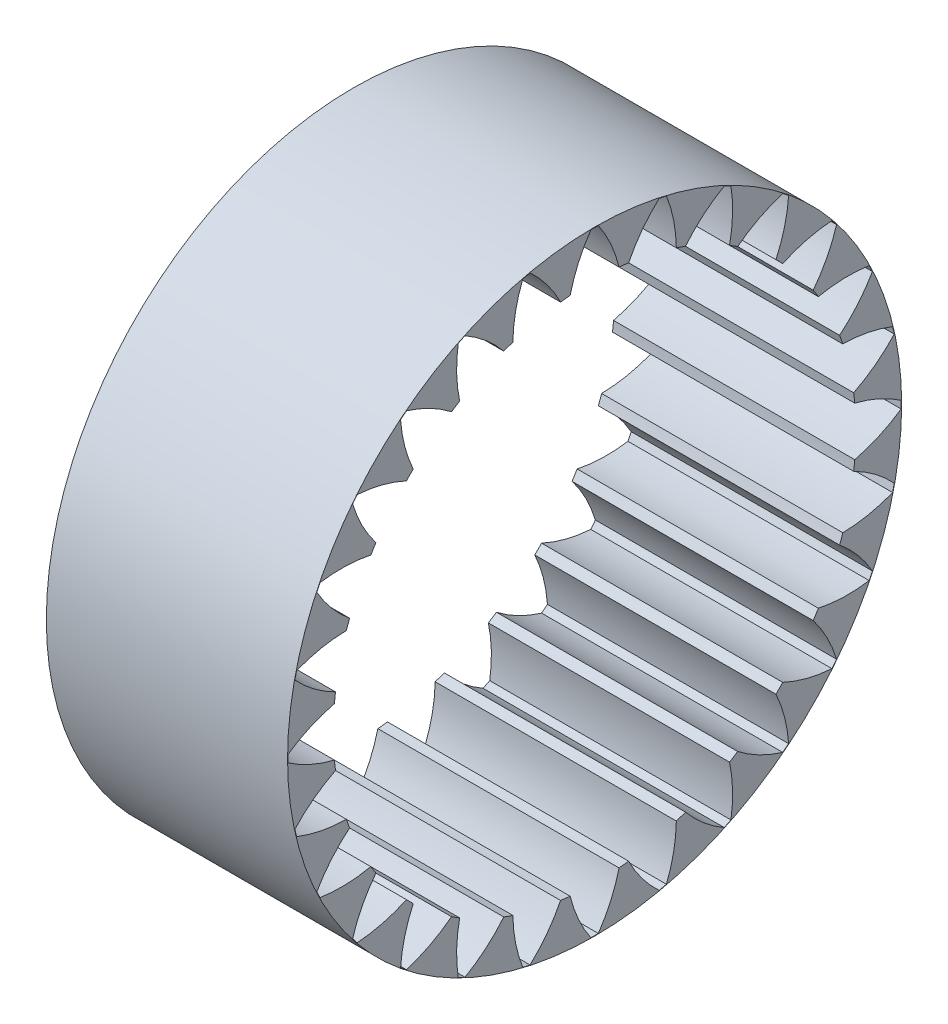
from build123d import *

# Parameters (mm, degrees)
BASPROSKE_W     = 12
BASPROSKE_H     = 2.2764
TOOTHCUT_DEPTH  = 25.713089526
TEETHCUTS_COUNT = 28
TEETHCUTS_ANGLE = 347.142857143


with BuildPart() as part:
    # BasProSke → Base-Revolve (revolve)
    with BuildSketch(Plane(origin=(0, 0, 0), x_dir=(1, 0, 0), z_dir=(0, 1, 0)), mode=Mode.PRIVATE) as base_revolve_sk:
        with Locations((6, 14.1382)):
            Rectangle(BASPROSKE_W, BASPROSKE_H)
    revolve(base_revolve_sk.sketch.rotate(Axis((-10, 0, 0), (1, 0, 0)), 180), axis=Axis((-10, 0, 0), (1, 0, 0)))

    # TooCutSke → ToothCut (cut, through all)
    with BuildSketch(Plane(origin=(0, 0, 0), x_dir=(0, 0, -1), z_dir=(1, 0, 0))):
        with BuildLine():
            ThreePointArc((1.223361493, 12.9167965), (0.811702044, 14.131060802), (0.185473285, 15.249872152))
            ThreePointArc((0.185473285, 15.249872152), (0, 15.251), (-0.185473285, 15.249872152))
            ThreePointArc((-0.185473285, 15.249872152), (-0.811702044, 14.131060802), (-1.223361493, 12.9167965))
            ThreePointArc((-1.223361493, 12.9167965), (0, 12.9746), (1.223361493, 12.9167965))
        make_face()
    toothcut = extrude(amount=TOOTHCUT_DEPTH, mode=Mode.SUBTRACT)

    # TeethCuts: ToothCut ×28 about axis
    teethcuts_axis = Axis((-10, 0, 0), (1, 0, 0))
    for i in range(1, TEETHCUTS_COUNT):
        add(toothcut.rotate(teethcuts_axis, i * TEETHCUTS_ANGLE / (TEETHCUTS_COUNT - 1)), mode=Mode.SUBTRACT)


solid = part.part
